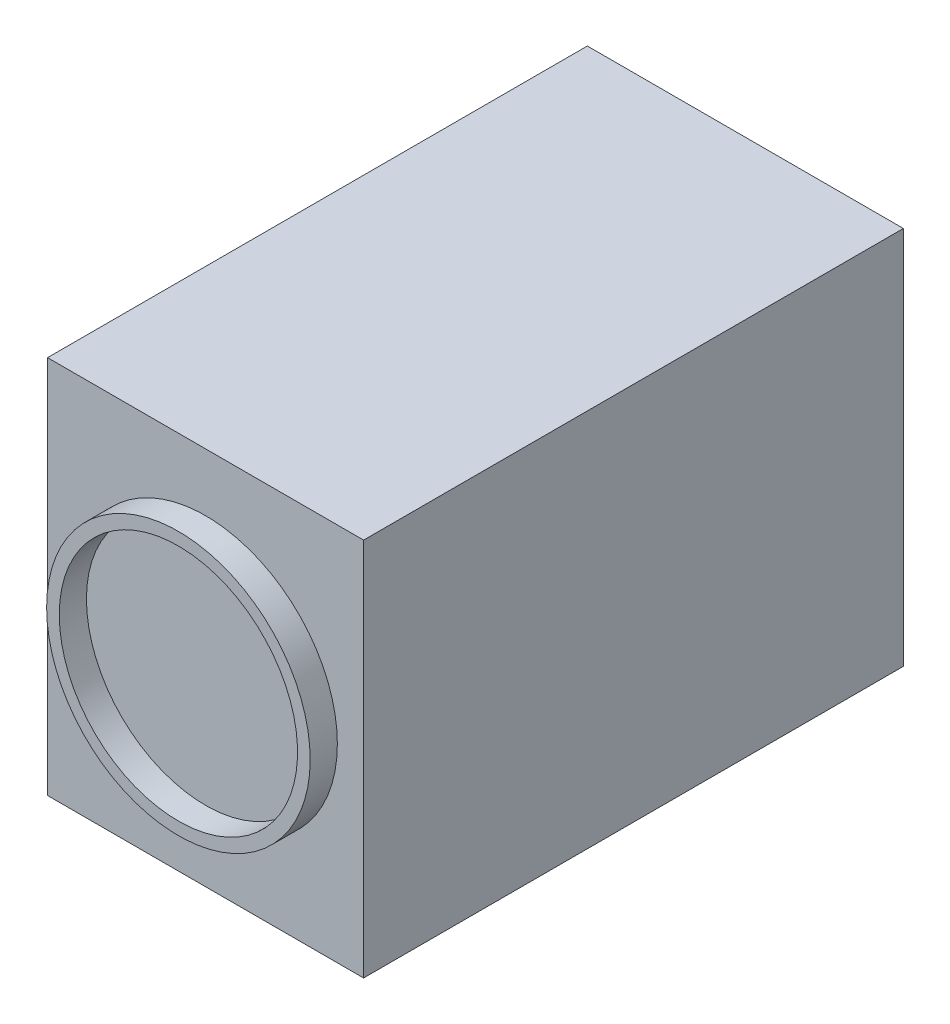
from build123d import *

# Parameters (mm, degrees)
SKETCH1_W                   = 50
SKETCH1_H                   = 60
BOSS_EXTRUDE1_DEPTH         = 85.4
SKETCH2_R                   = 20.85
SKETCH2_R_2                 = 18.85
BOSS_EXTRUDE2_DEPTH         = 4.3
F_1_4_20_TAPPED_HOLE1_D     = 5.1054
F_1_4_20_TAPPED_HOLE1_DEPTH = 10.16
F_1_4_20_TAPPED_HOLE1_TIP   = 1.533816902


with BuildPart() as part:
    # Sketch1 → Boss-Extrude1 (new body)
    with BuildSketch(Plane.XY):
        Rectangle(SKETCH1_W, SKETCH1_H)
    extrude(amount=BOSS_EXTRUDE1_DEPTH)

    # Sketch2 → Boss-Extrude2 (add)
    with BuildSketch(Plane.XY.offset(85.4)):
        with Locations(Location((0, 0, 0), (0, 0, 180))):
            Circle(SKETCH2_R)
        with Locations(Location((0, 0, 0), (0, 0, 180))):
            Circle(SKETCH2_R_2, mode=Mode.SUBTRACT)
    extrude(amount=BOSS_EXTRUDE2_DEPTH)

    # 1/4-20 Tapped Hole1
    with Locations(Plane(origin=(0, -30, 0), x_dir=(-1, 0, 0), z_dir=(0, -1, 0))):
        with Locations((0, -67.85)):
            Hole(F_1_4_20_TAPPED_HOLE1_D / 2, depth=F_1_4_20_TAPPED_HOLE1_DEPTH)
            with Locations((0, 0, -(F_1_4_20_TAPPED_HOLE1_DEPTH + F_1_4_20_TAPPED_HOLE1_TIP / 2))):  # 118° drill point
                Cone(0, F_1_4_20_TAPPED_HOLE1_D / 2, F_1_4_20_TAPPED_HOLE1_TIP, mode=Mode.SUBTRACT)


solid = part.part
